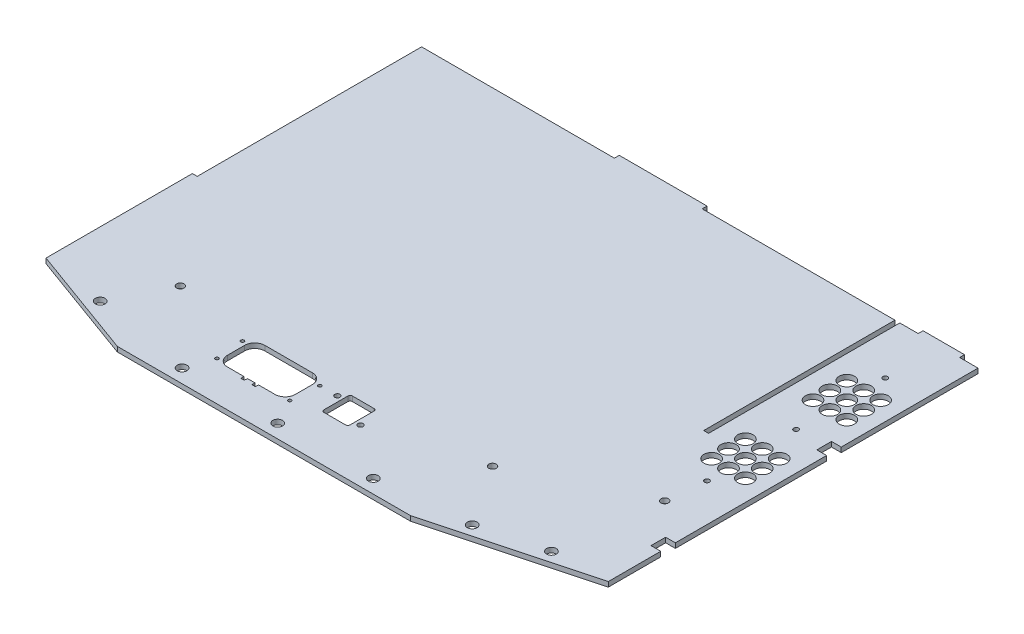
from build123d import *

# Parameters (mm, degrees)
SKETCH1_W                 = 308.08168
SKETCH1_H                 = 3.175
BOSS_EXTRUDE1_DEPTH       = 267.83
SKETCH3_W                 = 267.83
SKETCH3_H                 = 3.175
BOSS_EXTRUDE3_DEPTH       = 3.175
SKETCH4_W                 = 50.8889
SKETCH4_H                 = 3.175
BOSS_EXTRUDE4_DEPTH       = 267.83
CUT_EXTRUDE1_DEPTH        = 340.191055801
SKETCH19_R                = 5
CUT_EXTRUDE5_DEPTH        = 340.191055801
LPATTERN1_COUNT           = 3
LPATTERN1_PITCH           = 11
LPATTERN2_COUNT           = 3
LPATTERN2_PITCH           = 11
LPATTERN2_COPY_1_SKETCH_R = 5
LPATTERN2_COPY_1_DEPTH    = 340.191055801
LPATTERN2_COPY_2_SKETCH_R = 5
LPATTERN2_COPY_2_DEPTH    = 340.191055801
LPATTERN2_COPY_3_SKETCH_R = 5
LPATTERN2_COPY_3_DEPTH    = 340.191055801
LPATTERN2_COPY_4_SKETCH_R = 5
LPATTERN2_COPY_4_DEPTH    = 340.191055801
LPATTERN3_COUNT           = 2
LPATTERN3_PITCH           = 66
LPATTERN3_COPY_1_SKETCH_R = 5
LPATTERN3_COPY_1_DEPTH    = 340.191055801
LPATTERN3_COPY_2_SKETCH_R = 5
LPATTERN3_COPY_2_DEPTH    = 340.191055801
LPATTERN3_COPY_3_SKETCH_R = 5
LPATTERN3_COPY_3_DEPTH    = 340.191055801
LPATTERN3_COPY_4_SKETCH_R = 5
LPATTERN3_COPY_4_DEPTH    = 340.191055801
LPATTERN3_COPY_5_SKETCH_R = 5
LPATTERN3_COPY_5_DEPTH    = 340.191055801
LPATTERN3_COPY_6_SKETCH_R = 5
LPATTERN3_COPY_6_DEPTH    = 340.191055801
LPATTERN3_COPY_7_SKETCH_R = 5
LPATTERN3_COPY_7_DEPTH    = 340.191055801
LPATTERN3_COPY_8_SKETCH_R = 5
LPATTERN3_COPY_8_DEPTH    = 340.191055801
SKETCH21_W                = 267.83
SKETCH21_H                = 3.175
BOSS_EXTRUDE5_DEPTH       = 3.175
CUT_EXTRUDE3_DEPTH        = 340.191055801
SKETCH36_R                = 1.5875
CUT_EXTRUDE12_DEPTH       = 340.191055801
LPATTERN4_COUNT           = 3
LPATTERN4_PITCH           = 58
M4_CLEARANCE_HOLE1_D      = 4.8
SKETCH40_R                = 3.175
CUT_EXTRUDE13_DEPTH       = 340.191055801
CUT_EXTRUDE15_DEPTH       = 340.191055801
M3_CLEARANCE_HOLE1_D      = 3.4
SKETCH45_W                = 57.15
SKETCH45_H                = 3.175
SKETCH45_W_2              = 26.9875
BOSS_EXTRUDE6_DEPTH       = 3.175
SKETCH46_W                = 3.175
SKETCH46_H                = 124.4419914
CUT_EXTRUDE16_DEPTH       = 340.191055942
SKETCH47_W                = 3.175
SKETCH47_H                = 146.0243
CUT_EXTRUDE17_DEPTH       = 340.191055942
SKETCH48_W                = 6.35
SKETCH48_H                = 9.525
CUT_EXTRUDE18_DEPTH       = 340.191055942


with BuildPart() as part:
    # Sketch1 → Boss-Extrude1 (new body)
    with BuildSketch(Plane.XY):
        Rectangle(SKETCH1_W, SKETCH1_H)
    extrude(amount=BOSS_EXTRUDE1_DEPTH)

    # Sketch3 → Boss-Extrude3 (add)
    with BuildSketch(Plane(origin=(154.04084, 0, 0), x_dir=(0, 0, -1), z_dir=(1, 0, 0))):
        with Locations((-133.915, 0)):
            Rectangle(SKETCH3_W, SKETCH3_H)
    extrude(amount=BOSS_EXTRUDE3_DEPTH)

    # Sketch4 → Boss-Extrude4 (add)
    with BuildSketch(Plane.XY.offset(267.83)):
        with Locations((182.66029, 0)):
            Rectangle(SKETCH4_W, SKETCH4_H)
    extrude(amount=-BOSS_EXTRUDE4_DEPTH)

    # Sketch6 → Cut-Extrude1 (cut, through all)
    with BuildSketch(Plane(origin=(0, 1.5875, 0), x_dir=(1, 0, 0), z_dir=(0, 1, 0))):
        Polygon((208.10474, -240.606362049), (106.50474, -267.83), (208.10474, -267.83), align=None)
    extrude(amount=-CUT_EXTRUDE1_DEPTH, mode=Mode.SUBTRACT)

    # Sketch19 → Cut-Extrude5 (cut, through all)
    with BuildSketch(Plane(origin=(0, 1.5875, 0), x_dir=(1, 0, 0), z_dir=(0, 1, 0))):
        with Locations(Location((172.48674, -49.774823778, 0), (0, 0, 270))):
            Circle(SKETCH19_R)
    cut_extrude5 = extrude(amount=-CUT_EXTRUDE5_DEPTH, mode=Mode.SUBTRACT)

    # LPattern1: Cut-Extrude5 ×3
    with Locations(*[(i * LPATTERN1_PITCH, 0, 0) for i in range(1, LPATTERN1_COUNT)]):
        add(cut_extrude5, mode=Mode.SUBTRACT)

    # LPattern2: Cut-Extrude5 ×3
    with Locations(*[(0, 0, i * LPATTERN2_PITCH) for i in range(1, LPATTERN2_COUNT)]):
        add(cut_extrude5, mode=Mode.SUBTRACT)

    # LPattern2 copy 1 sketch → LPattern2 copy 1 (cut, through all)
    with BuildSketch(Plane(origin=(11, 1.5875, 11), x_dir=(1, 0, 0), z_dir=(0, 1, 0))):
        with Locations(Location((172.48674, -49.774823778, 0), (0, 0, 270))):
            Circle(LPATTERN2_COPY_1_SKETCH_R)
    extrude(amount=-LPATTERN2_COPY_1_DEPTH, mode=Mode.SUBTRACT)

    # LPattern2 copy 2 sketch → LPattern2 copy 2 (cut, through all)
    with BuildSketch(Plane(origin=(11, 1.5875, 22), x_dir=(1, 0, 0), z_dir=(0, 1, 0))):
        with Locations(Location((172.48674, -49.774823778, 0), (0, 0, 270))):
            Circle(LPATTERN2_COPY_2_SKETCH_R)
    extrude(amount=-LPATTERN2_COPY_2_DEPTH, mode=Mode.SUBTRACT)

    # LPattern2 copy 3 sketch → LPattern2 copy 3 (cut, through all)
    with BuildSketch(Plane(origin=(22, 1.5875, 11), x_dir=(1, 0, 0), z_dir=(0, 1, 0))):
        with Locations(Location((172.48674, -49.774823778, 0), (0, 0, 270))):
            Circle(LPATTERN2_COPY_3_SKETCH_R)
    extrude(amount=-LPATTERN2_COPY_3_DEPTH, mode=Mode.SUBTRACT)

    # LPattern2 copy 4 sketch → LPattern2 copy 4 (cut, through all)
    with BuildSketch(Plane(origin=(22, 1.5875, 22), x_dir=(1, 0, 0), z_dir=(0, 1, 0))):
        with Locations(Location((172.48674, -49.774823778, 0), (0, 0, 270))):
            Circle(LPATTERN2_COPY_4_SKETCH_R)
    extrude(amount=-LPATTERN2_COPY_4_DEPTH, mode=Mode.SUBTRACT)

    # LPattern3: Cut-Extrude5 ×2
    with Locations(*[(0, 0, i * LPATTERN3_PITCH) for i in range(1, LPATTERN3_COUNT)]):
        add(cut_extrude5, mode=Mode.SUBTRACT)

    # LPattern3 copy 1 sketch → LPattern3 copy 1 (cut, through all)
    with BuildSketch(Plane(origin=(11, 1.5875, 66), x_dir=(1, 0, 0), z_dir=(0, 1, 0))):
        with Locations(Location((172.48674, -49.774823778, 0), (0, 0, 270))):
            Circle(LPATTERN3_COPY_1_SKETCH_R)
    extrude(amount=-LPATTERN3_COPY_1_DEPTH, mode=Mode.SUBTRACT)

    # LPattern3 copy 2 sketch → LPattern3 copy 2 (cut, through all)
    with BuildSketch(Plane(origin=(22, 1.5875, 66), x_dir=(1, 0, 0), z_dir=(0, 1, 0))):
        with Locations(Location((172.48674, -49.774823778, 0), (0, 0, 270))):
            Circle(LPATTERN3_COPY_2_SKETCH_R)
    extrude(amount=-LPATTERN3_COPY_2_DEPTH, mode=Mode.SUBTRACT)

    # LPattern3 copy 3 sketch → LPattern3 copy 3 (cut, through all)
    with BuildSketch(Plane(origin=(0, 1.5875, 77), x_dir=(1, 0, 0), z_dir=(0, 1, 0))):
        with Locations(Location((172.48674, -49.774823778, 0), (0, 0, 270))):
            Circle(LPATTERN3_COPY_3_SKETCH_R)
    extrude(amount=-LPATTERN3_COPY_3_DEPTH, mode=Mode.SUBTRACT)

    # LPattern3 copy 4 sketch → LPattern3 copy 4 (cut, through all)
    with BuildSketch(Plane(origin=(0, 1.5875, 88), x_dir=(1, 0, 0), z_dir=(0, 1, 0))):
        with Locations(Location((172.48674, -49.774823778, 0), (0, 0, 270))):
            Circle(LPATTERN3_COPY_4_SKETCH_R)
    extrude(amount=-LPATTERN3_COPY_4_DEPTH, mode=Mode.SUBTRACT)

    # LPattern3 copy 5 sketch → LPattern3 copy 5 (cut, through all)
    with BuildSketch(Plane(origin=(11, 1.5875, 77), x_dir=(1, 0, 0), z_dir=(0, 1, 0))):
        with Locations(Location((172.48674, -49.774823778, 0), (0, 0, 270))):
            Circle(LPATTERN3_COPY_5_SKETCH_R)
    extrude(amount=-LPATTERN3_COPY_5_DEPTH, mode=Mode.SUBTRACT)

    # LPattern3 copy 6 sketch → LPattern3 copy 6 (cut, through all)
    with BuildSketch(Plane(origin=(11, 1.5875, 88), x_dir=(1, 0, 0), z_dir=(0, 1, 0))):
        with Locations(Location((172.48674, -49.774823778, 0), (0, 0, 270))):
            Circle(LPATTERN3_COPY_6_SKETCH_R)
    extrude(amount=-LPATTERN3_COPY_6_DEPTH, mode=Mode.SUBTRACT)

    # LPattern3 copy 7 sketch → LPattern3 copy 7 (cut, through all)
    with BuildSketch(Plane(origin=(22, 1.5875, 77), x_dir=(1, 0, 0), z_dir=(0, 1, 0))):
        with Locations(Location((172.48674, -49.774823778, 0), (0, 0, 270))):
            Circle(LPATTERN3_COPY_7_SKETCH_R)
    extrude(amount=-LPATTERN3_COPY_7_DEPTH, mode=Mode.SUBTRACT)

    # LPattern3 copy 8 sketch → LPattern3 copy 8 (cut, through all)
    with BuildSketch(Plane(origin=(22, 1.5875, 88), x_dir=(1, 0, 0), z_dir=(0, 1, 0))):
        with Locations(Location((172.48674, -49.774823778, 0), (0, 0, 270))):
            Circle(LPATTERN3_COPY_8_SKETCH_R)
    extrude(amount=-LPATTERN3_COPY_8_DEPTH, mode=Mode.SUBTRACT)

    # Sketch21 → Boss-Extrude5 (add)
    with BuildSketch(Plane.ZY.offset(154.04084)):
        with Locations((133.915, 0)):
            Rectangle(SKETCH21_W, SKETCH21_H)
    extrude(amount=BOSS_EXTRUDE5_DEPTH)

    # Sketch11 → Cut-Extrude3 (cut, through all)
    with BuildSketch(Plane.XZ.offset(1.5875)):
        Polygon((-157.21584, 241.2743), (-84.254653892, 267.83), (-157.21584, 267.83), align=None)
    extrude(amount=-CUT_EXTRUDE3_DEPTH, mode=Mode.SUBTRACT)

    # Sketch36 → Cut-Extrude12 (cut, symmetric)
    with BuildSketch(Plane(origin=(0, 1.5875, 0), x_dir=(1, 0, 0), z_dir=(0, 1, 0))):
        with Locations(Location((183.48674, -35.774823778, 0), (0, 0, 270))):
            Circle(SKETCH36_R)
    cut_extrude12 = extrude(amount=CUT_EXTRUDE12_DEPTH, both=True, mode=Mode.SUBTRACT)

    # LPattern4: Cut-Extrude12 ×3
    with Locations(*[(0, 0, i * LPATTERN4_PITCH) for i in range(1, LPATTERN4_COUNT)]):
        add(cut_extrude12, mode=Mode.SUBTRACT)

    # M4 Clearance Hole1 (through all)
    with Locations(Plane(origin=(0, 1.5875, 0), x_dir=(1, 0, 0), z_dir=(0, 1, 0))):
        with Locations((180.96500002, -176.776), (105.42905, -213.2849914), (-97.77095, -213.2849914)):
            Hole(M4_CLEARANCE_HOLE1_D / 2)

    # Sketch40 → Cut-Extrude13 (cut, through all)
    with BuildSketch(Plane(origin=(0, 1.5875, 0), x_dir=(1, 0, 0), z_dir=(0, 1, 0))):
        with Locations(Location((172.54474, -242.09298883, 0), (0, 0, 270))):
            Circle(SKETCH40_R)
        with Locations(Location((131.90474, -252.982444011, 0), (0, 0, 270))):
            Circle(SKETCH40_R)
        with Locations(Location((73.48474, -258.94, 0), (0, 0, 270))):
            Circle(SKETCH40_R)
        with Locations(Location((11.25474, -258.94, 0), (0, 0, 270))):
            Circle(SKETCH40_R)
        with Locations(Location((-50.97526, -258.94, 0), (0, 0, 270))):
            Circle(SKETCH40_R)
        with Locations(Location((-115.322188641, -247.921359373, 0), (0, 0, 270))):
            Circle(SKETCH40_R)
    extrude(amount=-CUT_EXTRUDE13_DEPTH, mode=Mode.SUBTRACT)

    # Sketch41 → Cut-Extrude15 (cut, through all)
    with BuildSketch(Plane(origin=(0, 1.5875, 0), x_dir=(1, 0, 0), z_dir=(0, 1, 0))):
        with BuildLine():
            Line((34.291998123, -219.319811977), (20.241998123, -219.319811977))
            add(Edge.make_bspline(
                [(20.241998123, -219.319811977), (20.05700587, -219.319811977), (19.695257967, -219.383443925), (19.162187461, -219.721001314), (18.824630071, -220.254071821), (18.760998123, -220.615819723), (18.760998123, -220.800811977)],
                knots=[0, 0, 0, 0, 0.25, 0.5, 0.75, 1, 1, 1, 1], degree=3))
            Line((18.760998123, -220.800811977), (18.760998123, -236.350811977))
            add(Edge.make_bspline(
                [(18.760998123, -236.350811977), (18.760998123, -236.53580423), (18.824630071, -236.897552133), (19.162187461, -237.430622639), (19.695257967, -237.768180028), (20.05700587, -237.831811977), (20.241998123, -237.831811977)],
                knots=[0, 0, 0, 0, 0.25, 0.5, 0.75, 1, 1, 1, 1], degree=3))
            Line((20.241998123, -237.831811977), (34.291998123, -237.831811977))
            add(Edge.make_bspline(
                [(34.291998123, -237.831811977), (34.476990376, -237.831811977), (34.838738279, -237.768180028), (35.371808785, -237.430622639), (35.709366175, -236.897552133), (35.772998123, -236.53580423), (35.772998123, -236.350811977)],
                knots=[0, 0, 0, 0, 0.25, 0.5, 0.75, 1, 1, 1, 1], degree=3))
            Line((35.772998123, -236.350811977), (35.772998123, -220.800811977))
            add(Edge.make_bspline(
                [(35.772998123, -220.800811977), (35.772998123, -220.615819723), (35.709366175, -220.254071821), (35.371808785, -219.721001314), (34.838738279, -219.383443925), (34.476990376, -219.319811977), (34.291998123, -219.319811977)],
                knots=[0, 0, 0, 0, 0.25, 0.5, 0.75, 1, 1, 1, 1], degree=3))
        make_face()
        with BuildLine():
            Line((-43.386072906, -225.830806026), (-43.386072906, -237.030806026))
            add(Edge.make_bspline(
                [(-43.386072906, -237.030806026), (-43.386072906, -237.431648795), (-43.316837193, -238.217289831), (-42.85331251, -239.876692243), (-41.596147178, -241.821880297), (-39.650959124, -243.07904563), (-37.991556712, -243.542570312), (-37.205915676, -243.611806026), (-36.805072906, -243.611806026)],
                knots=[0, 0, 0, 0, 0.125, 0.25, 0.5, 0.75, 0.875, 1, 1, 1, 1], degree=3))
            Line((-36.805072906, -243.611806026), (-26.154195078, -243.611806026))
            Line((-26.154195078, -243.611806026), (-25.979217705, -245.611806196))
            Line((-25.979217705, -245.611806196), (-23.830927999, -245.611806196))
            Line((-23.830927999, -245.611806196), (-23.655950719, -243.611806026))
            Line((-23.655950719, -243.611806026), (-18.954195078, -243.611806026))
            Line((-18.954195078, -243.611806026), (-18.779217705, -245.611806196))
            Line((-18.779217705, -245.611806196), (-16.630927999, -245.611806196))
            Line((-16.630927999, -245.611806196), (-16.455950719, -243.611806026))
            Line((-16.455950719, -243.611806026), (-5.805072906, -243.611806026))
            add(Edge.make_bspline(
                [(-5.805072906, -243.611806026), (-5.404230137, -243.611806026), (-4.618589101, -243.542570312), (-2.959186689, -243.07904563), (-1.013998635, -241.821880297), (0.243166697, -239.876692243), (0.70669138, -238.217289831), (0.775927094, -237.431648795), (0.775927094, -237.030806026)],
                knots=[0, 0, 0, 0, 0.125, 0.25, 0.5, 0.75, 0.875, 1, 1, 1, 1], degree=3))
            Line((0.775927094, -237.030806026), (0.775927094, -225.830806026))
            add(Edge.make_bspline(
                [(0.775927094, -225.830806026), (0.775927094, -225.429963257), (0.70669138, -224.64432222), (0.243166697, -222.984919809), (-1.013998635, -221.039731755), (-2.959186689, -219.782566422), (-4.618589101, -219.319041739), (-5.404230137, -219.249806026), (-5.805072906, -219.249806026)],
                knots=[0, 0, 0, 0, 0.125, 0.25, 0.5, 0.75, 0.875, 1, 1, 1, 1], degree=3))
            Line((-5.805072906, -219.249806026), (-36.805072906, -219.249806026))
            add(Edge.make_bspline(
                [(-36.805072906, -219.249806026), (-37.205915676, -219.249806026), (-37.991556712, -219.319041739), (-39.650959124, -219.782566422), (-41.596147178, -221.039731755), (-42.85331251, -222.984919809), (-43.316837193, -224.64432222), (-43.386072906, -225.429963257), (-43.386072906, -225.830806026)],
                knots=[0, 0, 0, 0, 0.125, 0.25, 0.5, 0.75, 0.875, 1, 1, 1, 1], degree=3))
        make_face()
        with BuildLine():
            add(Edge.make_bspline(
                [(1.309927323, -242.230806868), (1.309927323, -240.060806868), (3.479927323, -240.060806868), (3.479927323, -242.230806868)],
                knots=[0, 0, 0, 0, 1, 1, 1, 1], degree=3, weights=[1, 0.333333333, 0.333333333, 1]))
            add(Edge.make_bspline(
                [(3.479927323, -242.230806868), (3.479927323, -244.400806868), (1.309927323, -244.400806868), (1.309927323, -242.230806868)],
                knots=[0, 0, 0, 0, 1, 1, 1, 1], degree=3, weights=[1, 0.333333333, 0.333333333, 1]))
        make_face()
        with BuildLine():
            add(Edge.make_bspline(
                [(2.809927323, -224.130806868), (2.809927323, -221.960806868), (4.979927323, -221.960806868), (4.979927323, -224.130806868)],
                knots=[0, 0, 0, 0, 1, 1, 1, 1], degree=3, weights=[1, 0.333333333, 0.333333333, 1]))
            add(Edge.make_bspline(
                [(4.979927323, -224.130806868), (4.979927323, -226.300806868), (2.809927323, -226.300806868), (2.809927323, -224.130806868)],
                knots=[0, 0, 0, 0, 1, 1, 1, 1], degree=3, weights=[1, 0.333333333, 0.333333333, 1]))
        make_face()
        with BuildLine():
            add(Edge.make_bspline(
                [(-46.090072677, -242.230806868), (-46.090072677, -240.060806868), (-43.920072677, -240.060806868), (-43.920072677, -242.230806868)],
                knots=[0, 0, 0, 0, 1, 1, 1, 1], degree=3, weights=[1, 0.333333333, 0.333333333, 1]))
            add(Edge.make_bspline(
                [(-43.920072677, -242.230806868), (-43.920072677, -244.400806868), (-46.090072677, -244.400806868), (-46.090072677, -242.230806868)],
                knots=[0, 0, 0, 0, 1, 1, 1, 1], degree=3, weights=[1, 0.333333333, 0.333333333, 1]))
        make_face()
        with BuildLine():
            add(Edge.make_bspline(
                [(-45.420072677, -224.130806868), (-45.420072677, -226.300806868), (-47.590072677, -226.300806868), (-47.590072677, -224.130806868)],
                knots=[0, 0, 0, 0, 1, 1, 1, 1], degree=3, weights=[1, 0.333333333, 0.333333333, 1]))
            add(Edge.make_bspline(
                [(-47.590072677, -224.130806868), (-47.590072677, -221.960806868), (-45.420072677, -221.960806868), (-45.420072677, -224.130806868)],
                knots=[0, 0, 0, 0, 1, 1, 1, 1], degree=3, weights=[1, 0.333333333, 0.333333333, 1]))
        make_face()
    extrude(amount=-CUT_EXTRUDE15_DEPTH, mode=Mode.SUBTRACT)

    # M3 Clearance Hole1 (through all)
    with Locations(Plane(origin=(0, 1.5875, 0), x_dir=(1, 0, 0), z_dir=(0, 1, 0))):
        with Locations((39.266998249, -233.075811977), (15.266998249, -224.075811977)):
            Hole(M3_CLEARANCE_HOLE1_D / 2)

    # Sketch45 → Boss-Extrude6 (add)
    with BuildSketch(Plane(origin=(0, 0, 0), x_dir=(-1, 0, 0), z_dir=(0, 0, -1))):
        Rectangle(SKETCH45_W, SKETCH45_H)
        with Locations((-182.66100002, 0)):
            Rectangle(SKETCH45_W_2, SKETCH45_H)
    extrude(amount=BOSS_EXTRUDE6_DEPTH)

    # Sketch46 → Cut-Extrude16 (cut, through all)
    with BuildSketch(Plane(origin=(0, 1.5875, 0), x_dir=(1, 0, 0), z_dir=(0, 1, 0))):
        with Locations((155.62850002, -62.2209957)):
            Rectangle(SKETCH46_W, SKETCH46_H)
    extrude(amount=-CUT_EXTRUDE16_DEPTH, mode=Mode.SUBTRACT)

    # Sketch47 → Cut-Extrude17 (cut, through all)
    with BuildSketch(Plane(origin=(0, 1.5875, 0), x_dir=(1, 0, 0), z_dir=(0, 1, 0))):
        with Locations((-155.62834, -73.01215)):
            Rectangle(SKETCH47_W, SKETCH47_H)
    extrude(amount=-CUT_EXTRUDE17_DEPTH, mode=Mode.SUBTRACT)

    # Sketch48 → Cut-Extrude18 (cut, through all)
    with BuildSketch(Plane(origin=(0, 1.5875, 0), x_dir=(1, 0, 0), z_dir=(0, 1, 0))):
        with Locations((204.92974, -201.724823778)):
            Rectangle(SKETCH48_W, SKETCH48_H)
        with Locations((204.92974, -93.774823778)):
            Rectangle(SKETCH48_W, SKETCH48_H)
    extrude(amount=-CUT_EXTRUDE18_DEPTH, mode=Mode.SUBTRACT)


solid = part.part
